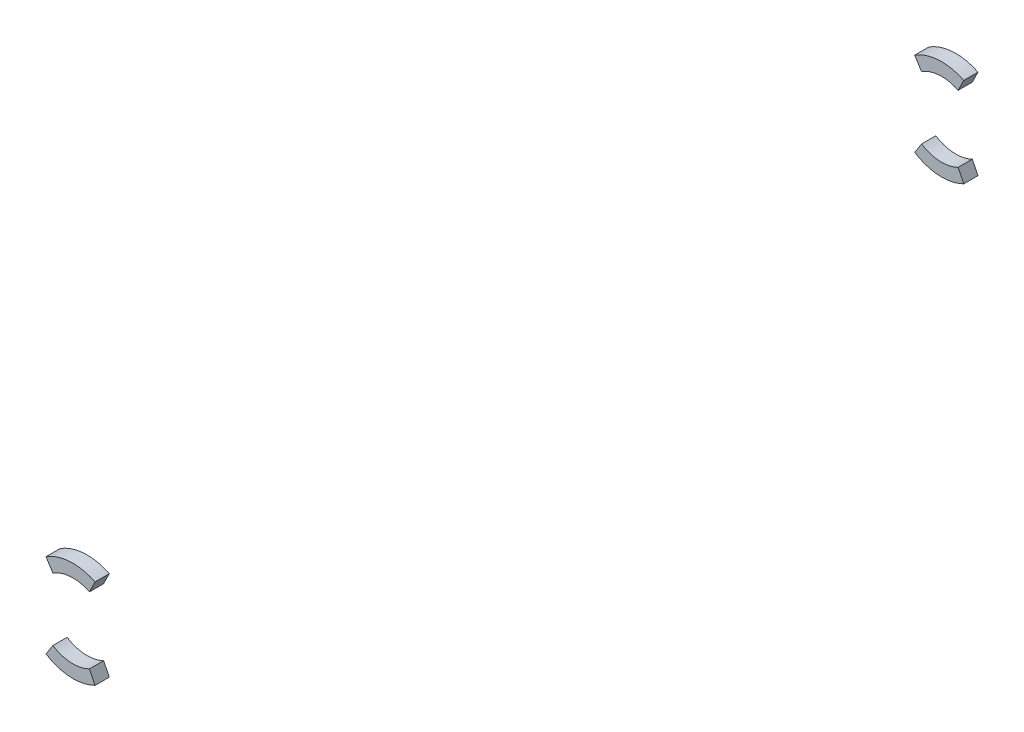
from build123d import *

# Parameters (mm, degrees)
BOSS_EXTRUDE2_DEPTH   = 20
BOSS_EXTRUDE2_2_DEPTH = 20
LPATTERN1_COUNT       = 2
LPATTERN1_PITCH       = 1220


with BuildPart() as part:
    # Sketch2 → Boss-Extrude2 (new body)
    with BuildSketch(Plane.XY):
        with BuildLine():
            Line((-37.821455886, 59.139003749), (-28.160126305, 44.032197495))
            ThreePointArc((-28.160126305, 44.032197495), (-2.870393775, 52.188005991), (23.161241474, 46.854925281))
            Line((23.161241474, 46.854925281), (31.107526408, 62.930168366))
            ThreePointArc((31.107526408, 62.930168366), (-3.855184113, 70.092951467), (-37.821455886, 59.139003749))
        make_face()
    boss_extrude2 = extrude(amount=-BOSS_EXTRUDE2_DEPTH)


with BuildPart() as body_2:
    # Sketch2 → Boss-Extrude2 2 (new body)
    with BuildSketch(Plane.XY):
        with BuildLine():
            Line((31.107526408, -62.930168366), (23.161241474, -46.854925281))
            ThreePointArc((23.161241474, -46.854925281), (-2.870393775, -52.188005991), (-28.160126305, -44.032197495))
            Line((-28.160126305, -44.032197495), (-37.821455886, -59.139003749))
            ThreePointArc((-37.821455886, -59.139003749), (-3.855184113, -70.092951467), (31.107526408, -62.930168366))
        make_face()
    boss_extrude2_2 = extrude(amount=-BOSS_EXTRUDE2_2_DEPTH)


with BuildPart() as lpattern1_1:
    # LPattern1: Boss-Extrude2, Boss-Extrude2 2 ×2
    with Locations(*[(0, 0, i * LPATTERN1_PITCH) for i in range(1, LPATTERN1_COUNT)]):
        add(boss_extrude2)
        add(boss_extrude2_2)


solid = Compound([part.part, body_2.part, lpattern1_1.part])
